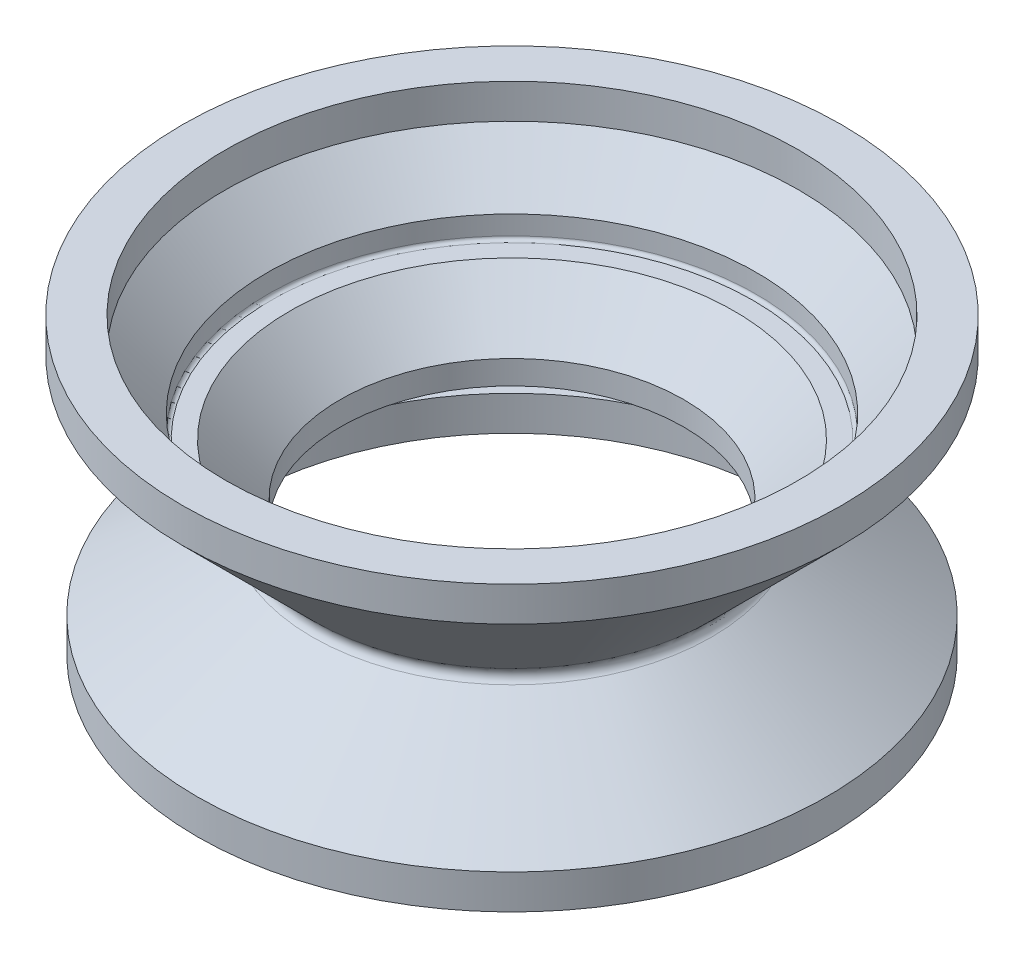
from build123d import *

# Parameters (mm, degrees)
FILLET3_R           = 0.2
FILLET5_R           = 0.1
SKETCH2_R           = 19.042006499
SKETCH2_R_2         = 16.542006499
BOSS_EXTRUDE1_DEPTH = 2
SKETCH3_R           = 18.182746533
SKETCH3_R_2         = 15.682746533
BOSS_EXTRUDE2_DEPTH = 2
MIDDLE_FILLLET_R    = 0.5


with BuildPart() as part:
    # Sketch1 → Revolve1 (revolve)
    with BuildSketch(Plane.XY, mode=Mode.PRIVATE) as revolve1_sk:
        Polygon((-17, 8), (-14.120151906, 5.074731621), (-14.120151906, 3.778145407), (-12.843697628, 3.778145407), (-9.924215024, 0.812617411), (-9.924215024, -0.560166031), (-12.924215024, -2.660788645), (-13.945322255, -2.660788645), (-13.945322255, -3.375775626), (-16.264955058, -5), (-18.182746533, -5), (-11.042006499, 0), (-19.042006499, 8), align=None)
    revolve(revolve1_sk.sketch.rotate(Axis((0, 30.18306827, 0), (0, -1, 0)), 270), axis=Axis((0, 30.18306827, 0), (0, -1, 0)))

    # Fillet3
    fillet3_edges = [part.edges().sort_by_distance(p)[0] for p in [
        (0, 3.778145407, -14.120151906),
    ]]
    fillet(fillet3_edges, radius=FILLET3_R)

    # Fillet5
    fillet5_edges = [part.edges().sort_by_distance(p)[0] for p in [
        (0, -2.660788645, -13.945322255),
    ]]
    fillet(fillet5_edges, radius=FILLET5_R)

    # Sketch2 → Boss-Extrude1 (add)
    with BuildSketch(Plane(origin=(0, 8, 0), x_dir=(1, 0, 0), z_dir=(0, 1, 0))):
        with Locations(Location((0, 0, 0), (0, 0, 270))):
            Circle(SKETCH2_R)
        with Locations(Location((0, 0, 0), (0, 0, 270))):
            Circle(SKETCH2_R_2, mode=Mode.SUBTRACT)
    extrude(amount=BOSS_EXTRUDE1_DEPTH)

    # Sketch3 → Boss-Extrude2 (add)
    with BuildSketch(Plane.XZ.offset(5)):
        with Locations(Location((0, 0, 0), (0, 0, 270))):
            Circle(SKETCH3_R)
        with Locations(Location((0, 0, 0), (0, 0, 270))):
            Circle(SKETCH3_R_2, mode=Mode.SUBTRACT)
    extrude(amount=BOSS_EXTRUDE2_DEPTH)

    # middle_filllet
    middle_filllet_edges = [part.edges().sort_by_distance(p)[0] for p in [
        (0, 0, -11.042006499),
    ]]
    fillet(middle_filllet_edges, radius=MIDDLE_FILLLET_R)


solid = part.part
